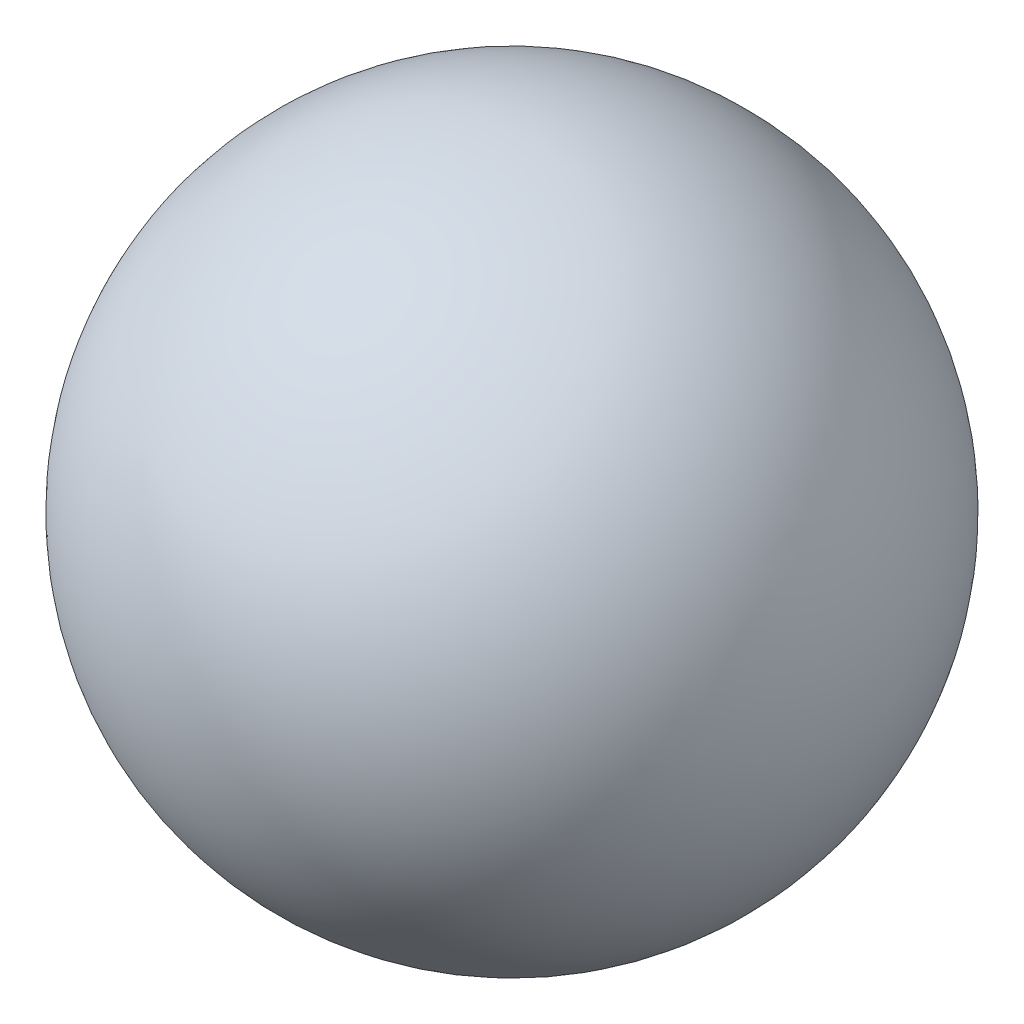
from build123d import *

# Parameters (mm, degrees)
SCALE1_SCALE = 0.35


with BuildPart() as part:
    # Sketch1 → Revolve1 (revolve)
    with BuildSketch(Plane.XY):
        with BuildLine():
            Line((-12, 0), (12, 0))
            ThreePointArc((12, 0), (0, -12), (-12, 0))
        make_face()
    revolve(axis=Axis((-12, 0, 0), (1, 0, 0)))


with BuildPart() as part_1:
    # Scale1: scaled about (0, 0, 0)
    add(part.part.scale(SCALE1_SCALE))


solid = part_1.part
